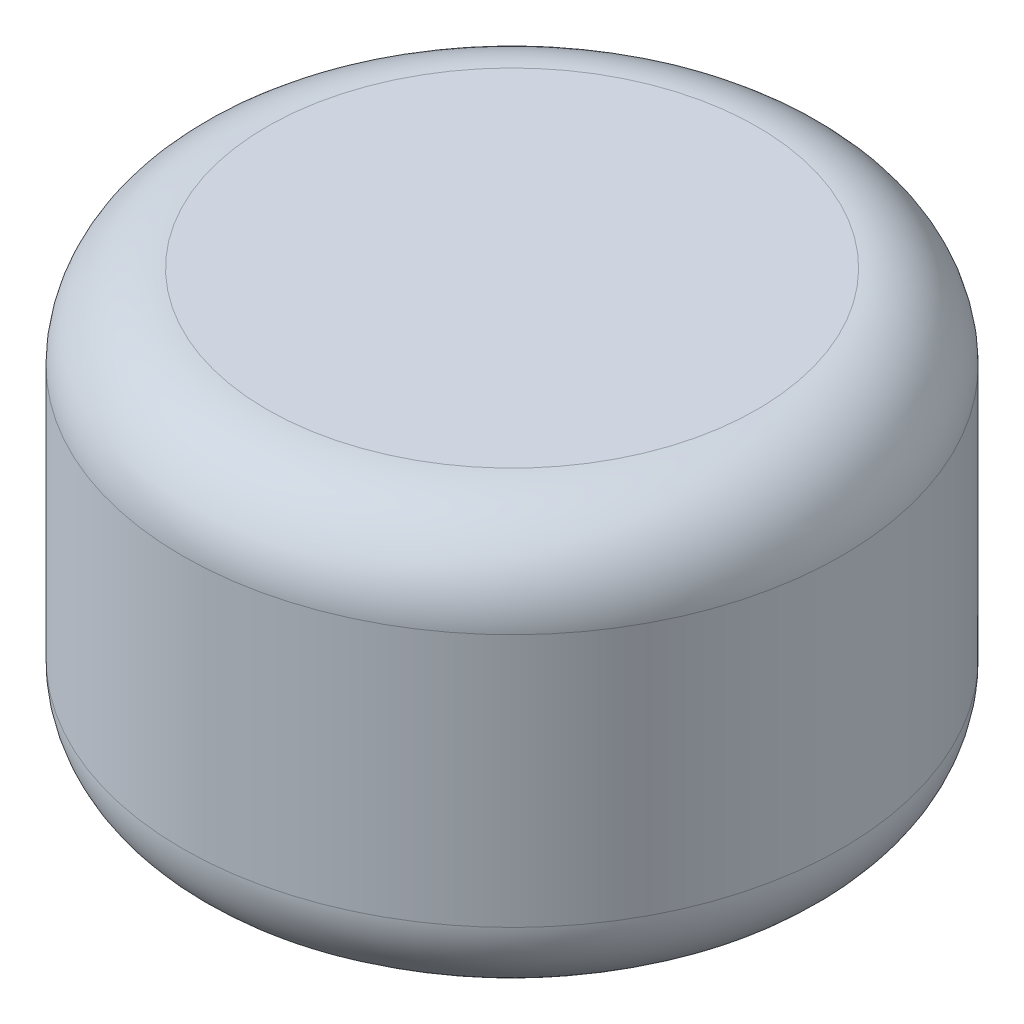
from build123d import *

# Parameters (mm, degrees)
SKETCH1_R           = 49.53
BOSS_EXTRUDE1_DEPTH = 63.5
FILLET1_R           = 12.7


with BuildPart() as part:
    # Sketch1 → Boss-Extrude1 (new body)
    with BuildSketch(Plane(origin=(0, 0, 0), x_dir=(1, 0, 0), z_dir=(0, 1, 0))):
        with Locations(Location((0, 0, 0), (0, 0, 270))):
            Circle(SKETCH1_R)
    extrude(amount=BOSS_EXTRUDE1_DEPTH)

    # Fillet1
    fillet1_edges = [part.edges().sort_by_distance(p)[0] for p in [
        (0, 0, -49.53),
        (0, 63.5, -49.53),
    ]]
    fillet(fillet1_edges, radius=FILLET1_R)


solid = part.part
